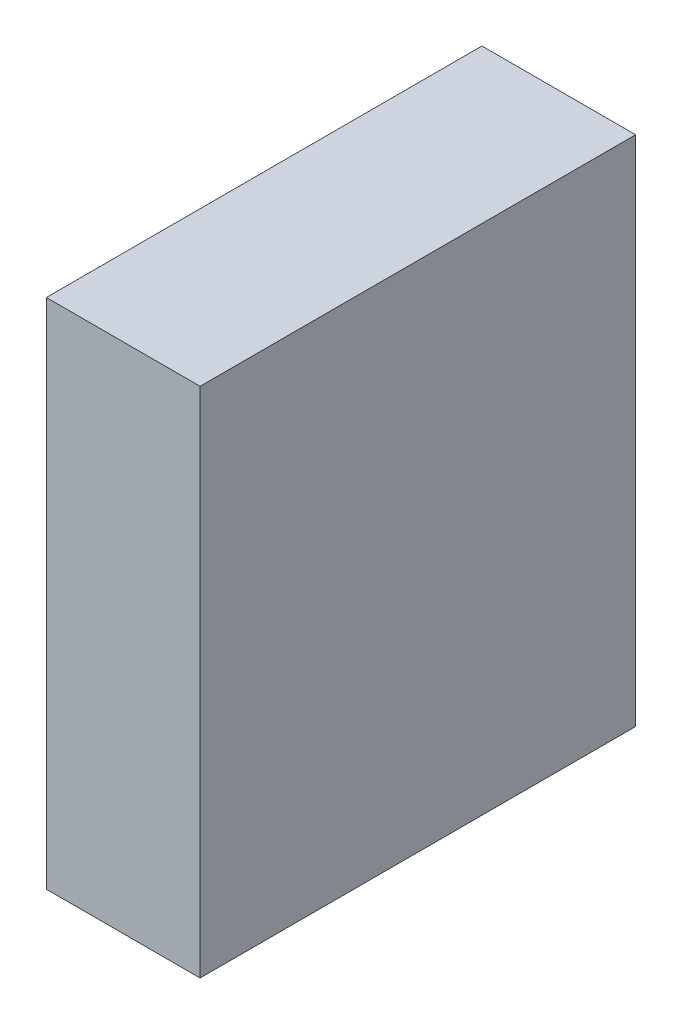
from build123d import *

# Parameters (mm, degrees)
SKETCH1_W           = 76.2
SKETCH1_H           = 215.9
BOSS_EXTRUDE1_DEPTH = 254


with BuildPart() as part:
    # Sketch1 → Boss-Extrude1 (new body)
    with BuildSketch(Plane(origin=(0, 0, 0), x_dir=(1, 0, 0), z_dir=(0, 1, 0))):
        Rectangle(SKETCH1_W, SKETCH1_H)
    extrude(amount=BOSS_EXTRUDE1_DEPTH)


solid = part.part
